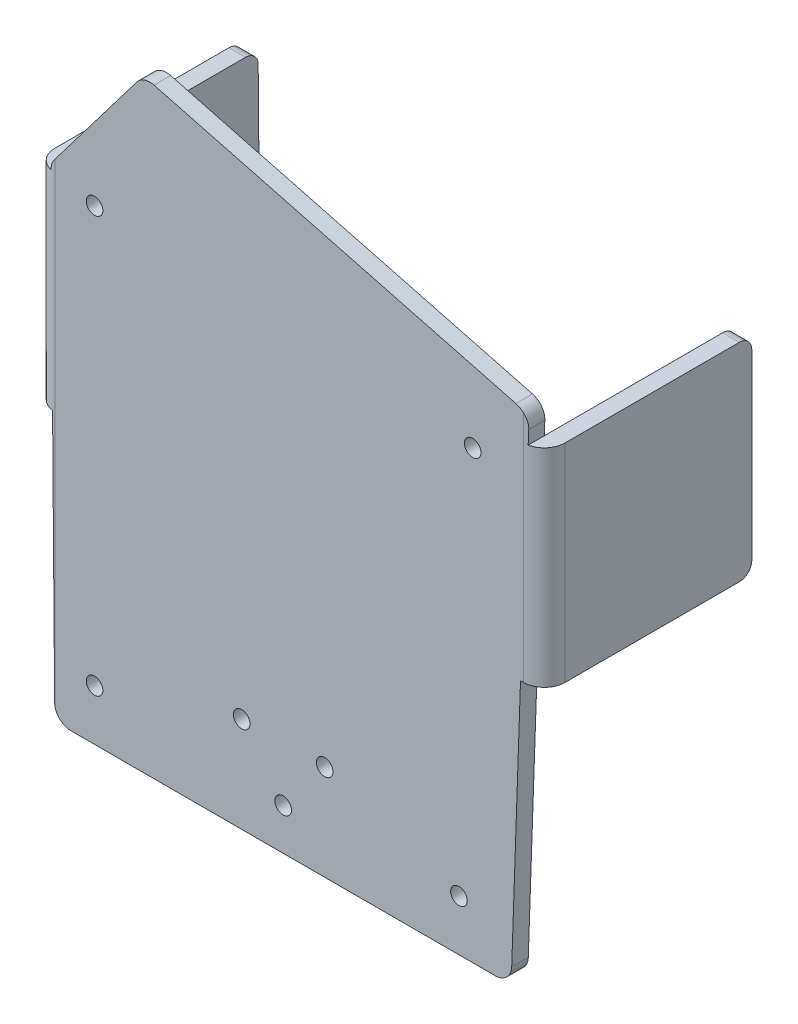
from build123d import *

# Parameters (mm, degrees)
SKETCH1_R             = 1
BOSS_EXTRUDE1_DEPTH   = 2
BOSS_EXTRUDE2_DEPTH   = 23
BOSS_EXTRUDE2_2_DEPTH = 23
BOSS_EXTRUDE3_DEPTH   = 2
FILLET1_R             = 2.5
FILLET2_R             = 1.5


with BuildPart() as part:
    # Sketch1 → Boss-Extrude1 (new body)
    with BuildSketch(Plane.XY):
        with BuildLine():
            Line((-1.914568893, 0), (-53.034632217, 0))
            ThreePointArc((-53.034632217, 0), (-54.430407674, 0.574584772), (-55.017150852, 1.965292948))
            Line((-55.017150852, 1.965292948), (-55.500249363, 57.322899279))
            ThreePointArc((-55.500249363, 57.322899279), (-55.399437354, 57.964587872), (-55.09663904, 58.539253421))
            Line((-55.09663904, 58.539253421), (-45.118252169, 71.678754712))
            ThreePointArc((-45.118252169, 71.678754712), (-44.186512298, 72.353695471), (-43.03683386, 72.39755554))
            Line((-43.03683386, 72.39755554), (0.580818713, 60.968995882))
            ThreePointArc((0.580818713, 60.968995882), (1.66875601, 60.234846813), (2.059695099, 58.981950551))
            Line((2.059695099, 58.981950551), (0.066817491, 1.913402589))
            ThreePointArc((0.066817491, 1.913402589), (-0.537343288, 0.556435263), (-1.914568893, 0))
        make_face()
        with Locations((-27.474600555, 5)):
            Circle(SKETCH1_R, mode=Mode.SUBTRACT)
        with Locations((-22.474600555, 11.5)):
            Circle(SKETCH1_R, mode=Mode.SUBTRACT)
        with Locations((-32.474600555, 11.5)):
            Circle(SKETCH1_R, mode=Mode.SUBTRACT)
        with Locations((-6.292158567, 6.135518638)):
            Circle(SKETCH1_R, mode=Mode.SUBTRACT)
        with Locations((-50.206815558, 6.135518638)):
            Circle(SKETCH1_R, mode=Mode.SUBTRACT)
        with Locations((-50.206815558, 56.218481747)):
            Circle(SKETCH1_R, mode=Mode.SUBTRACT)
        with Locations((-4.635001699, 53.732746446)):
            Circle(SKETCH1_R, mode=Mode.SUBTRACT)
    extrude(amount=BOSS_EXTRUDE1_DEPTH)



with BuildPart() as body_2:
    # Sketch2 → Boss-Extrude2 (new body)
    with BuildSketch(Plane(origin=(0, 0, 0), x_dir=(-1, 0, 0), z_dir=(0, 0, -1))):
        Polygon((-4.001759752, 32.322899279), (-1.128740515, 32.322899279), (-2.001759752, 57.322899279), (-4.001759752, 57.322899279), align=None)
    extrude(amount=BOSS_EXTRUDE2_DEPTH)


with BuildPart() as body_3:
    # Sketch2 → Boss-Extrude2 2 (new body)
    with BuildSketch(Plane(origin=(0, 0, 0), x_dir=(-1, 0, 0), z_dir=(0, 0, -1))):
        Polygon((57.500249363, 57.322899279), (55.500249363, 57.322899279), (55.282077669, 32.322899279), (57.500249363, 32.322899279), align=None)
    extrude(amount=BOSS_EXTRUDE2_2_DEPTH)


with BuildPart() as part_1:
    add(part.part)

    add(body_2.part)  # Boss-Extrude3 merges body 2

    add(body_3.part)  # Boss-Extrude3 merges body 3
    # Sketch3 → Boss-Extrude3 (add)
    with BuildSketch(Plane.XY):
        Polygon((-57.500249363, 57.322899279), (-55.500249363, 57.322899279), (-55.282077669, 32.322899279), (-57.500249363, 32.322899279), align=None)
        Polygon((2.001759752, 57.322899279), (4.001759752, 57.322899279), (4.001759752, 32.322899279), (1.128740515, 32.322899279), align=None)
    extrude(amount=BOSS_EXTRUDE3_DEPTH)

    # Fillet1
    fillet1_edges = [part_1.edges().sort_by_distance(p)[0] for p in [
        (4.001759752, 44.822899279, 2),
        (-57.500249363, 44.822899279, 2),
    ]]
    fillet(fillet1_edges, radius=FILLET1_R)

    # Fillet2
    fillet2_edges = [part_1.edges().sort_by_distance(p)[0] for p in [
        (3.001759752, 57.322899279, -23),
        (2.565250134, 32.322899279, -23),
        (-56.500249363, 57.322899279, -23),
        (-56.391163516, 32.322899279, -23),
    ]]
    fillet(fillet2_edges, radius=FILLET2_R)


solid = part_1.part
